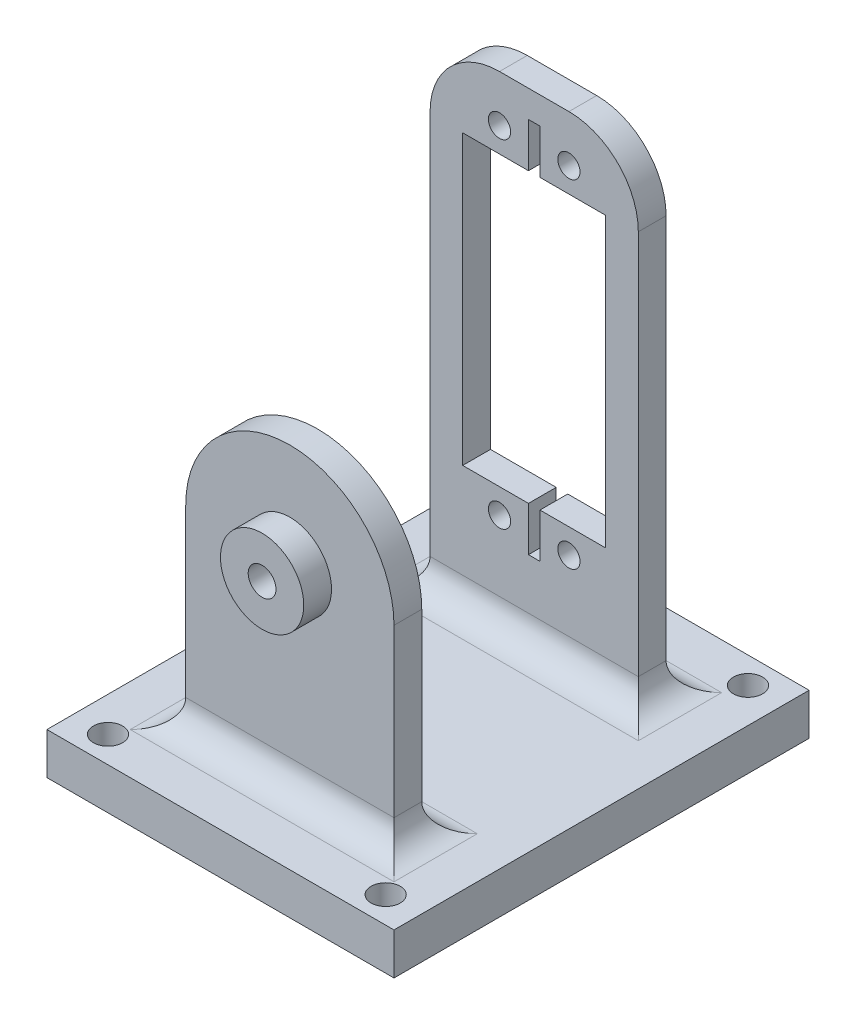
from build123d import *

# Parameters (mm, degrees)
SKETCH1_R           = 1.6
BOSS_EXTRUDE1_DEPTH = 4
BOSS_EXTRUDE2_DEPTH = 4
SKETCH3_R           = 6
BOSS_EXTRUDE3_DEPTH = 4
SKETCH4_R           = 2
CUT_EXTRUDE1_DEPTH  = 62.753461441
SKETCH5_W           = 50
SKETCH5_H           = 59.8
BOSS_EXTRUDE4_DEPTH = 6
SKETCH6_R           = 2.1
CUT_EXTRUDE2_DEPTH  = 6
FILLET1_R           = 4


with BuildPart() as part:
    # Sketch1 → Boss-Extrude1 (new body)
    with BuildSketch(Plane.XY):
        with BuildLine():
            Line((-15, -28), (15, -28))
            Line((15, -28), (15, 31.5))
            ThreePointArc((15, 31.5), (12.071067812, 38.571067812), (5, 41.5))
            Line((5, 41.5), (-5, 41.5))
            ThreePointArc((-5, 41.5), (-12.071067812, 38.571067812), (-15, 31.5))
            Line((-15, 31.5), (-15, -28))
        make_face()
        with Locations((-5, 34.75)):
            Circle(SKETCH1_R, mode=Mode.SUBTRACT)
        with Locations((-5, -13.85)):
            Circle(SKETCH1_R, mode=Mode.SUBTRACT)
        with Locations(Location((5, 34.75, 0), (0, 0, 180))):
            Circle(SKETCH1_R, mode=Mode.SUBTRACT)
        with Locations(Location((5, -13.85, 0), (0, 0, 180))):
            Circle(SKETCH1_R, mode=Mode.SUBTRACT)
        Polygon((-10.3, -10.3), (-0.83, -10.3), (-0.83, -16.7), (0.83, -16.7), (0.83, -10.3), (10.3, -10.3), (10.3, 31.2), (0.83, 31.2), (0.83, 37.6), (-0.83, 37.6), (-0.83, 31.2), (-10.3, 31.2), align=None, mode=Mode.SUBTRACT)
    extrude(amount=BOSS_EXTRUDE1_DEPTH)



with BuildPart() as body_2:
    # Sketch2 → Boss-Extrude2 (new body)
    with BuildSketch(Plane.XY.offset(39.2)):
        with BuildLine():
            Line((-15, -28), (15, -28))
            Line((15, -28), (15, 0))
            ThreePointArc((15, 0), (0, 15), (-15, 0))
            Line((-15, 0), (-15, -28))
        make_face()
    extrude(amount=-BOSS_EXTRUDE2_DEPTH)

    # Sketch3 → Boss-Extrude3 (add)
    with BuildSketch(Plane.XY.offset(39.2)):
        Circle(SKETCH3_R)
    extrude(amount=BOSS_EXTRUDE3_DEPTH)

    # Sketch4 → Cut-Extrude1 (cut, through all)
    with BuildSketch(Plane.XY.offset(43.2)):
        Circle(SKETCH4_R)
    extrude(amount=-CUT_EXTRUDE1_DEPTH, mode=Mode.SUBTRACT)


with BuildPart() as part_1:
    add(part.part)

    add(body_2.part)  # Boss-Extrude4 merges body 2
    # Sketch5 → Boss-Extrude4 (add)
    with BuildSketch(Plane(origin=(0, -28, 0), x_dir=(1, 0, 0), z_dir=(0, 1, 0))):
        with Locations((0, -19.3)):
            Rectangle(SKETCH5_W, SKETCH5_H)
    extrude(amount=-BOSS_EXTRUDE4_DEPTH)

    # Sketch6 → Cut-Extrude2 (cut)
    with BuildSketch(Plane.XZ.offset(34)):
        with Locations(Location((-20, 45.4, 0), (0, 0, 270))):
            Circle(SKETCH6_R)
        with Locations(Location((20, 45.4, 0), (0, 0, 90))):
            Circle(SKETCH6_R)
        with Locations(Location((20, -6.8, 0), (0, 0, 270))):
            Circle(SKETCH6_R)
        with Locations(Location((-20, -6.8, 0), (0, 0, 90))):
            Circle(SKETCH6_R)
    extrude(amount=-CUT_EXTRUDE2_DEPTH, mode=Mode.SUBTRACT)

    # Fillet1
    fillet1_edges = [part_1.edges().sort_by_distance(p)[0] for p in [
        (15, -28, 2),
        (-15, -28, 2),
        (0, -28, 0),
        (-15, -28, 37.2),
        (0, -28, 35.2),
        (15, -28, 37.2),
        (0, -28, 39.2),
        (0, -28, 4),
    ]]
    fillet(fillet1_edges, radius=FILLET1_R)


solid = part_1.part
